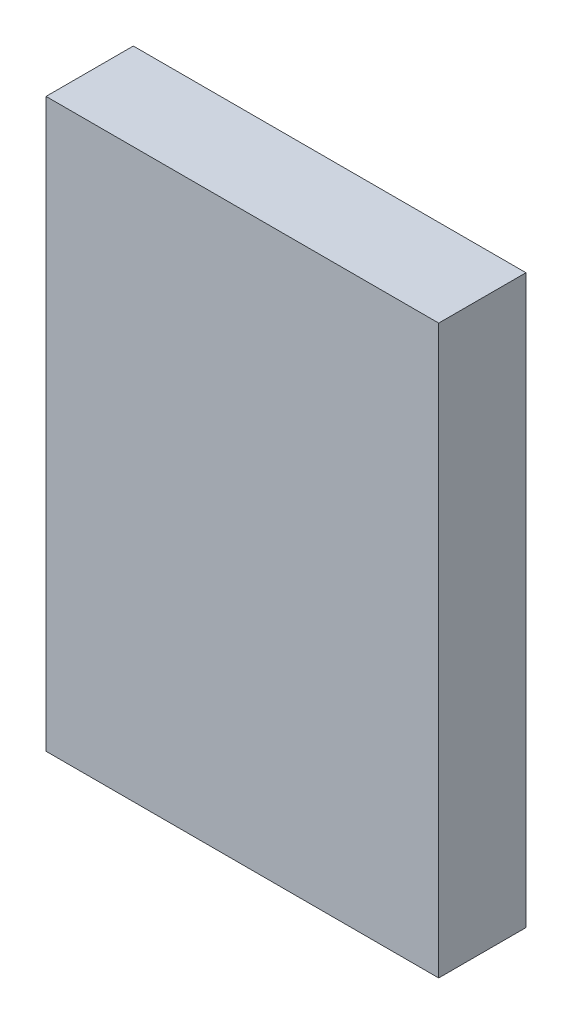
from build123d import *

# Parameters (mm, degrees)
ESQUISSE1_W        = 57.15
ESQUISSE1_H        = 82.55
BOSS_EXTRU_1_DEPTH = 12.7


with BuildPart() as part:
    # Esquisse1 → Boss.-Extru.1 (new body)
    with BuildSketch(Plane.XY):
        Rectangle(ESQUISSE1_W, ESQUISSE1_H)
    extrude(amount=BOSS_EXTRU_1_DEPTH)


solid = part.part
